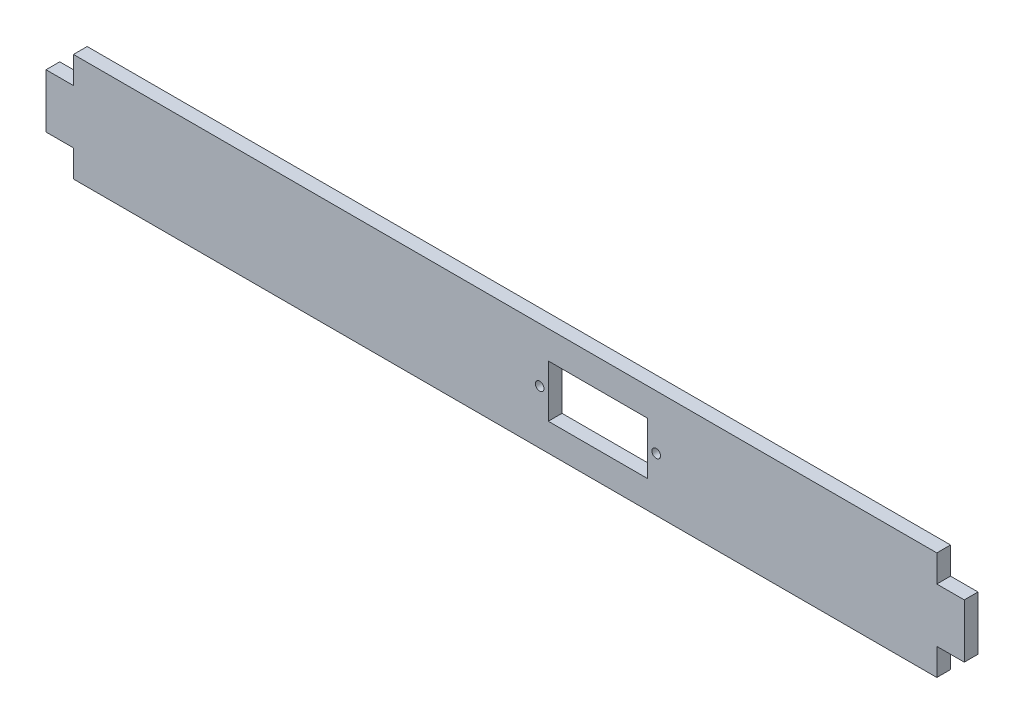
from build123d import *

# Parameters (mm, degrees)
SKETCH2_W           = 200
SKETCH2_H           = 25
BOSS_EXTRUDE1_DEPTH = 1.59
SKETCH4_R           = 1
SKETCH4_W           = 23
SKETCH4_H           = 12.1
CUT_EXTRUDE1_DEPTH  = 3.18
SKETCH5_W           = 6.36
SKETCH5_H           = 12.5
BOSS_EXTRUDE2_DEPTH = 3.18


with BuildPart() as part:
    # Sketch2 → Boss-Extrude1 (new, symmetric)
    with BuildSketch(Plane.XY):
        with Locations((100, 12.5)):
            Rectangle(SKETCH2_W, SKETCH2_H)
    extrude(amount=BOSS_EXTRUDE1_DEPTH, both=True)

    # Sketch4 → Cut-Extrude1 (cut)
    with BuildSketch(Plane(origin=(0, 0, -1.59), x_dir=(-1, 0, 0), z_dir=(0, 0, -1))):
        with Locations((-135, 12.457546073)):
            Circle(SKETCH4_R)
        with Locations((-108, 12.457546073)):
            Circle(SKETCH4_R)
        with Locations((-121.5, 12.457546073)):
            Rectangle(SKETCH4_W, SKETCH4_H)
    extrude(amount=-CUT_EXTRUDE1_DEPTH, mode=Mode.SUBTRACT)

    # Sketch5 → Boss-Extrude2 (add)
    with BuildSketch(Plane(origin=(0, 0, -1.59), x_dir=(-1, 0, 0), z_dir=(0, 0, -1))):
        with Locations((-203.18, 12.5)):
            Rectangle(SKETCH5_W, SKETCH5_H)
        with Locations((3.18, 12.5)):
            Rectangle(SKETCH5_W, SKETCH5_H)
    extrude(amount=-BOSS_EXTRUDE2_DEPTH)


solid = part.part
